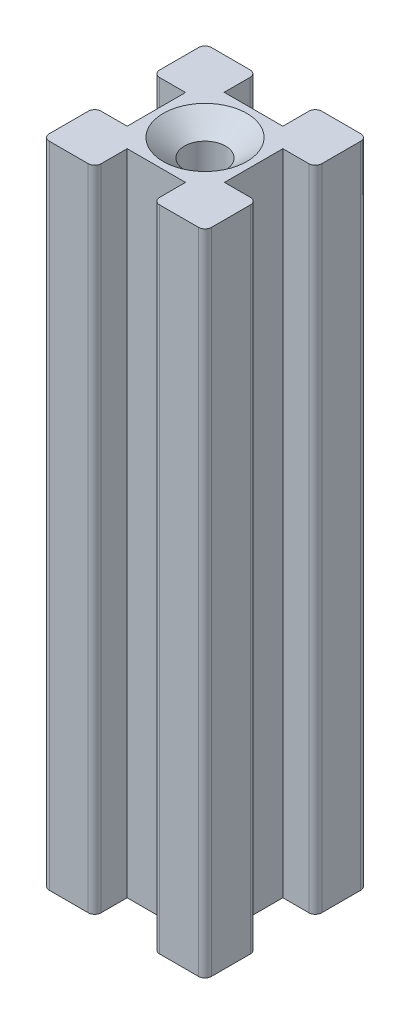
from build123d import *

# Parameters (mm, degrees)
SKETCH1_W                             = 25
SKETCH1_H                             = 25
BOSS_EXTRUDE1_DEPTH                   = 100
SKETCH2_W                             = 5
SKETCH2_H                             = 9
SKETCH2_W_2                           = 9
SKETCH2_H_2                           = 5
SKETCH2_W_3                           = 9.048888394
CUT_EXTRUDE1_DEPTH                    = 100
FILLET1_R                             = 1
F_1_4_0_25_DIAMETER_HOLE1_D           = 6.35
F_1_4_0_25_DIAMETER_HOLE1_CSINK_D     = 12.8778
F_1_4_0_25_DIAMETER_HOLE1_CSINK_ANGLE = 100


with BuildPart() as part:
    # Sketch1 → Boss-Extrude1 (new body)
    with BuildSketch(Plane(origin=(0, 0, 0), x_dir=(1, 0, 0), z_dir=(0, 1, 0))):
        Rectangle(SKETCH1_W, SKETCH1_H)
    extrude(amount=BOSS_EXTRUDE1_DEPTH)

    # Sketch2 → Cut-Extrude1 (cut)
    with BuildSketch(Plane(origin=(0, 100, 0), x_dir=(1, 0, 0), z_dir=(0, 1, 0))):
        with Locations((-10, 0)):
            Rectangle(SKETCH2_W, SKETCH2_H)
        with Locations((0, -10)):
            Rectangle(SKETCH2_W_2, SKETCH2_H_2)
        with Locations((-0.024444197, 10)):
            Rectangle(SKETCH2_W_3, SKETCH2_H_2)
        with Locations((10, 0)):
            Rectangle(SKETCH2_W, SKETCH2_H)
    extrude(amount=-CUT_EXTRUDE1_DEPTH, mode=Mode.SUBTRACT)

    # Fillet1
    fillet1_edges = [part.edges().sort_by_distance(p)[0] for p in [
        (-12.5, 50, 4.5),
        (-12.5, 50, -4.5),
        (-4.548888394, 50, -12.5),
        (4.5, 50, -12.5),
        (-4.5, 50, 12.5),
        (4.5, 50, 12.5),
        (12.5, 50, -4.5),
        (12.5, 50, 4.5),
        (12.5, 50, 12.5),
        (-12.5, 50, 12.5),
        (-12.5, 50, -12.5),
        (12.5, 50, -12.5),
    ]]
    fillet(fillet1_edges, radius=FILLET1_R)

    # 1/4 (0.25) Diameter Hole1 (through all)
    with Locations(Plane(origin=(0, 100, 0), x_dir=(1, 0, 0), z_dir=(0, 1, 0))):
        with Locations((0, 0)):
            CounterSinkHole(F_1_4_0_25_DIAMETER_HOLE1_D / 2, F_1_4_0_25_DIAMETER_HOLE1_CSINK_D / 2, counter_sink_angle=F_1_4_0_25_DIAMETER_HOLE1_CSINK_ANGLE)


solid = part.part
